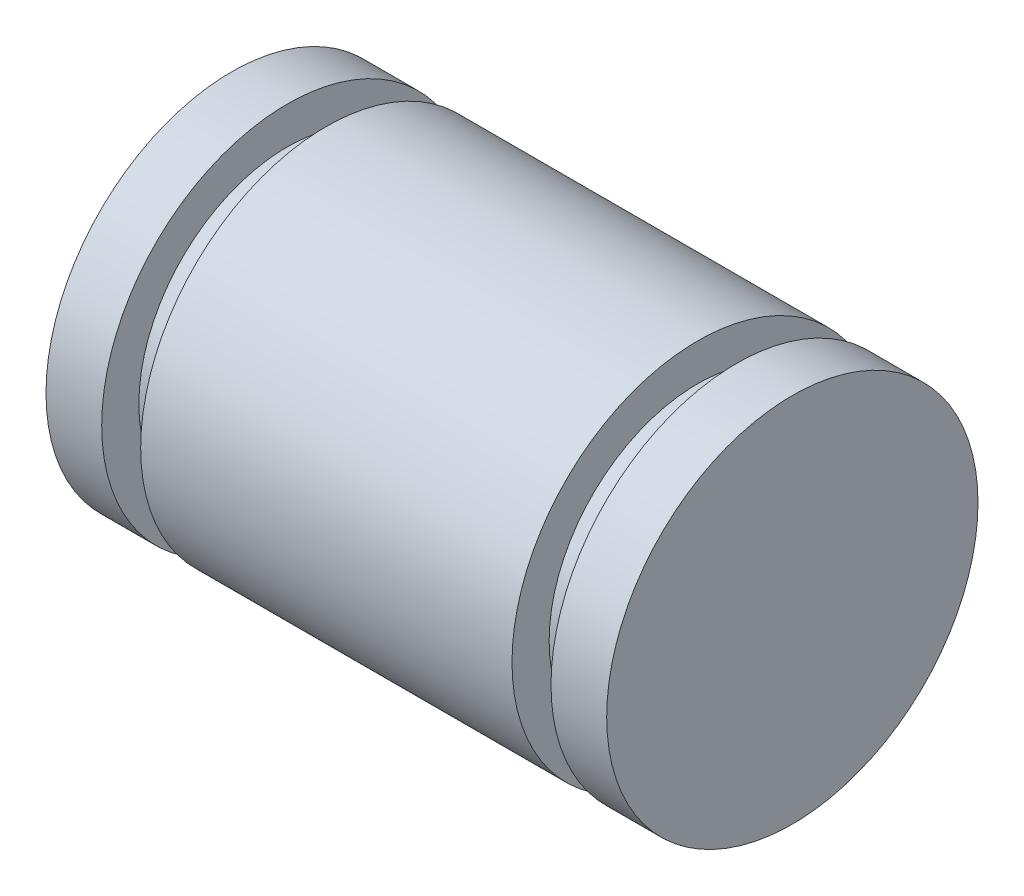
from build123d import *


with BuildPart() as part:
    # Sketch1 → Revolve1 (revolve)
    with BuildSketch(Plane.XY, mode=Mode.PRIVATE) as revolve1_sk:
        Polygon((0, -5), (1.5, -5), (1.5, -4), (2.55, -4), (2.55, -5), (12.55, -5), (12.55, -4), (13.6, -4), (13.6, -5), (15.1, -5), (15.1, 0), (0, 0), align=None)
    revolve(revolve1_sk.sketch.rotate(Axis((0, 0, 0), (1, 0, 0)), 270), axis=Axis((0, 0, 0), (1, 0, 0)))


solid = part.part
